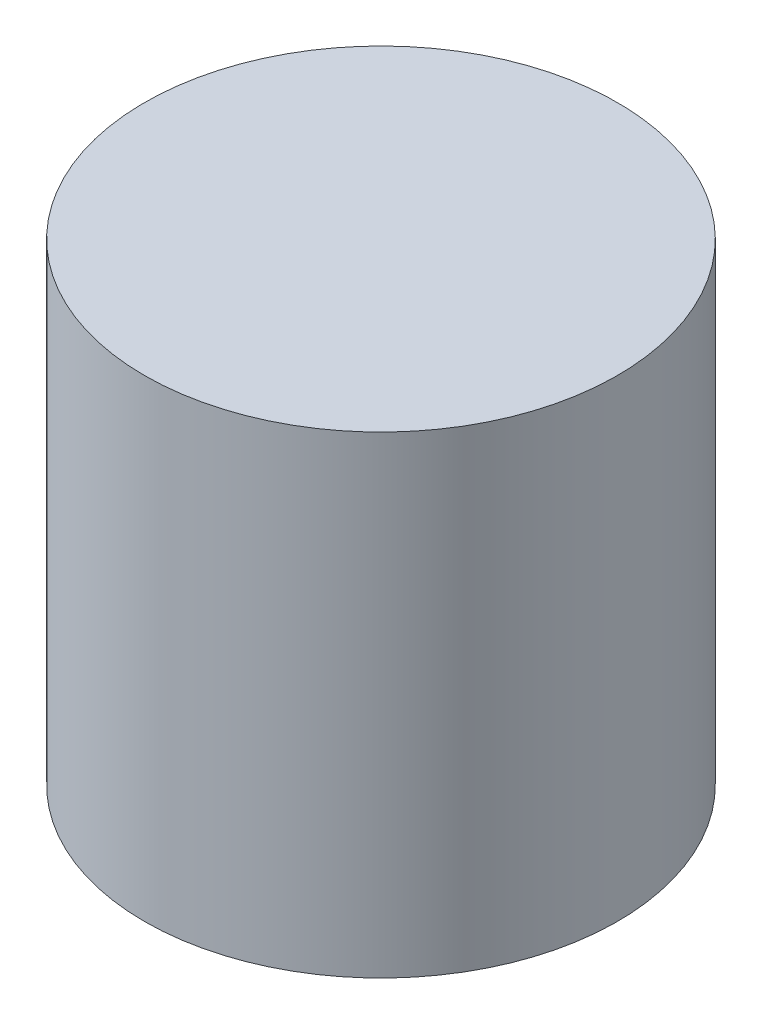
from build123d import *

# Parameters (mm, degrees)
SKETCH1_R           = 3
BOSS_EXTRUDE1_DEPTH = 6


with BuildPart() as part:
    # Sketch1 → Boss-Extrude1 (new body)
    with BuildSketch(Plane(origin=(0, 0, 0), x_dir=(1, 0, 0), z_dir=(0, 1, 0))):
        with Locations(Location((0, 0, 0), (0, 0, 270))):
            Circle(SKETCH1_R)
    extrude(amount=BOSS_EXTRUDE1_DEPTH)


solid = part.part
